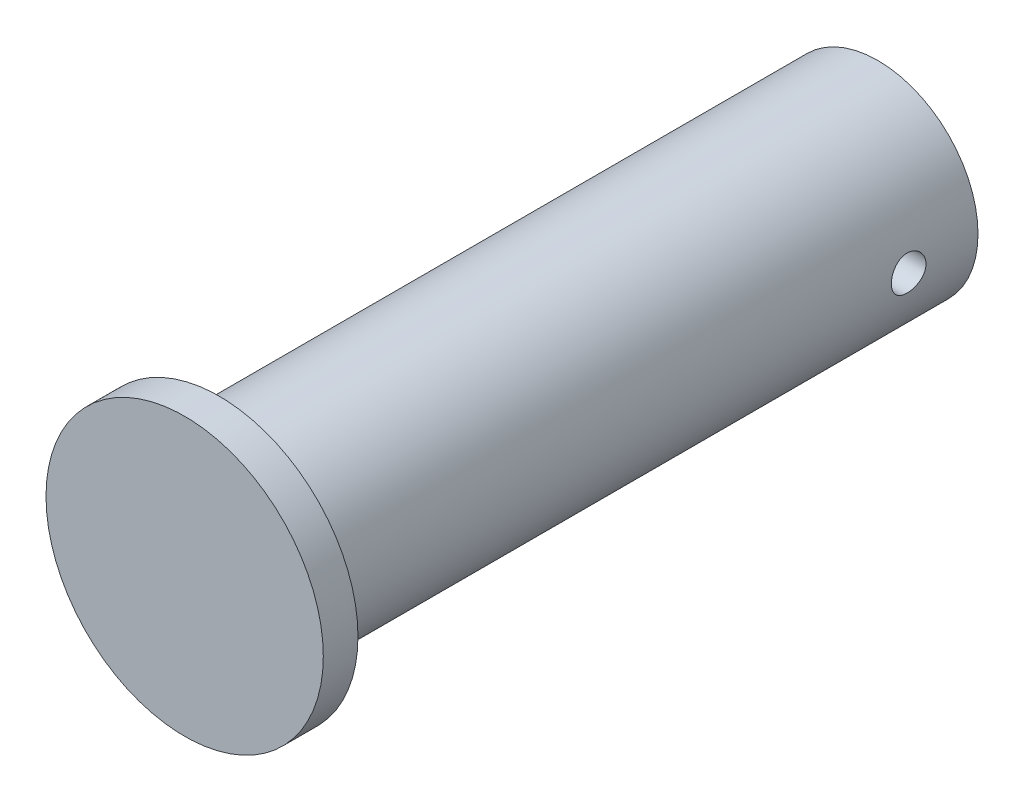
from build123d import *

# Parameters (mm, degrees)
SKETCH_1_R               = 14.44
EXTRUDE_1_DEPTH          = 100
SKETCH_3_R               = 20
EXTRUDE_3_DEPTH          = 5
CUT_EXTRUDE_1_DEPTH      = 104.923048454
CUT_EXTRUDE_1_DEPTH_BACK = 104.923048454
SKETCH_4_R               = 2.5


with BuildPart() as part:
    # 草图1 → 凸台-拉伸1 (new body)
    with BuildSketch(Plane.XY):
        Circle(SKETCH_1_R)
    extrude(amount=EXTRUDE_1_DEPTH)

    # 草图3 → 凸台-拉伸3 (add)
    with BuildSketch(Plane.XY.offset(100)):
        Circle(SKETCH_3_R)
    extrude(amount=-EXTRUDE_3_DEPTH)

    # 草图4 → 切除-拉伸1 (cut, two sides: drawn at the far end of the back side and taken through both)
    with BuildSketch(Plane(origin=(0, 0, 0), x_dir=(0, 0, -1), z_dir=(1, 0, 0)).offset(-CUT_EXTRUDE_1_DEPTH_BACK)):
        with Locations(Location((-10, 0, 0), (0, 0, 180))):
            Circle(SKETCH_4_R)
    extrude(amount=CUT_EXTRUDE_1_DEPTH + CUT_EXTRUDE_1_DEPTH_BACK, mode=Mode.SUBTRACT)


solid = part.part
